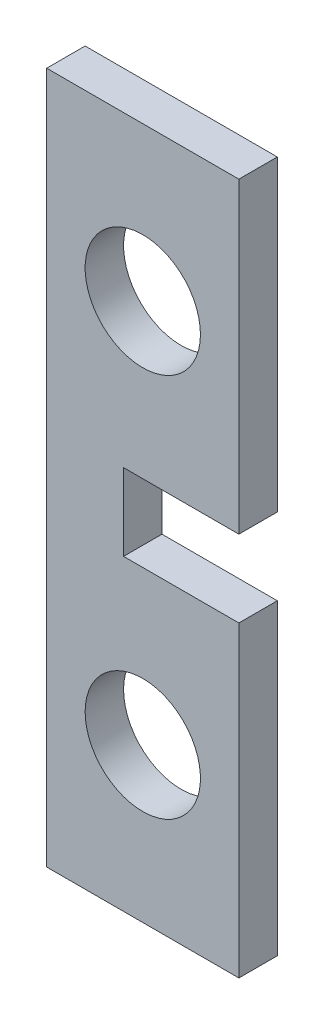
from build123d import *

# Parameters (mm, degrees)
SKETCH1_W           = 5
SKETCH1_H           = 18
BOSS_EXTRUDE1_DEPTH = 1
SKETCH2_R           = 1.5
SKETCH2_W           = 3
SKETCH2_H           = 2
CUT_EXTRUDE1_DEPTH  = 10.394147114


with BuildPart() as part:
    # Sketch1 → Boss-Extrude1 (new body)
    with BuildSketch(Plane.XY):
        Rectangle(SKETCH1_W, SKETCH1_H)
    extrude(amount=BOSS_EXTRUDE1_DEPTH)

    # Sketch2 → Cut-Extrude1 (cut, through all)
    with BuildSketch(Plane.XY.offset(1)):
        with Locations((0, 5)):
            Circle(SKETCH2_R)
        with Locations(Location((0, -5, 0), (0, 0, 180))):
            Circle(SKETCH2_R)
        with Locations((1, 0)):
            Rectangle(SKETCH2_W, SKETCH2_H)
    extrude(amount=-CUT_EXTRUDE1_DEPTH, mode=Mode.SUBTRACT)


solid = part.part
